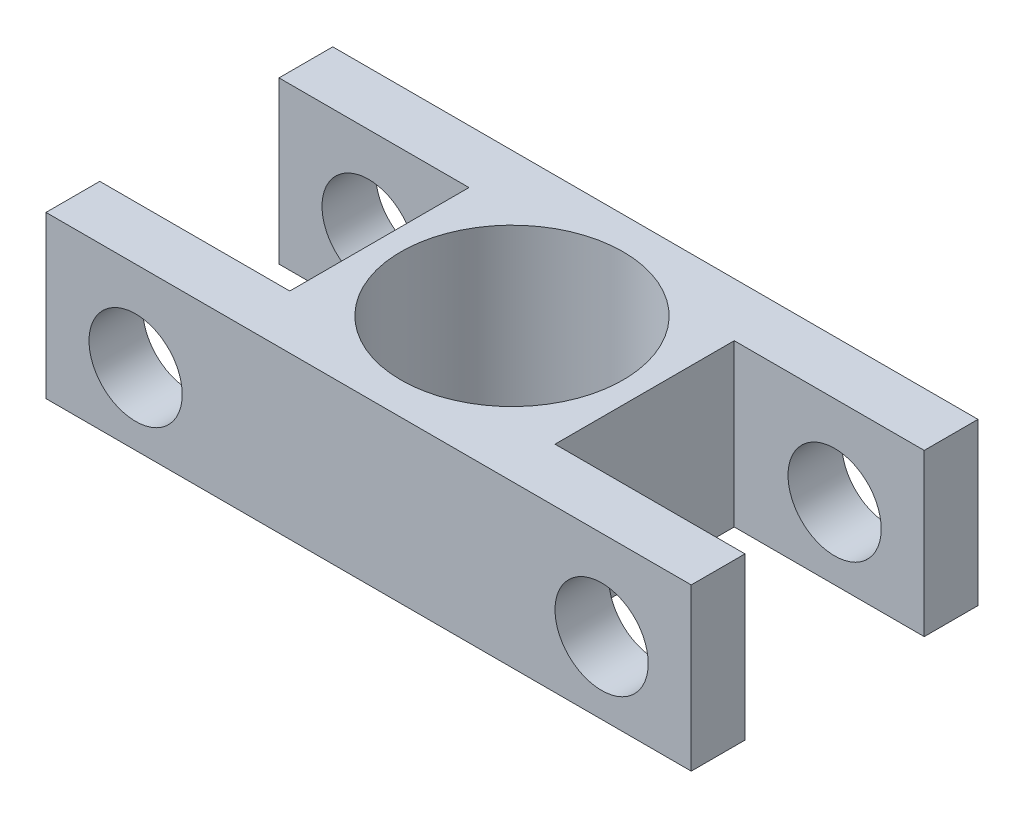
from build123d import *

# Parameters (mm, degrees)
SKETCH_1_W              = 36
SKETCH_1_H              = 9
BLOCKEXTRUDE_DEPTH      = 16
SKETCH_3_W              = 12.6
SKETCH_3_H              = 13
CLEVIS_SLOT_DEPTH       = 5
SKETCH_4_W              = 12.6
SKETCH_4_H              = 13
CUT_EXTRUDE_2_DEPTH     = 5
SKETCH_5_R              = 2.6
PIVOT_BORE_DEPTH        = 41.410394702
SKETCH_6_R              = 2.6
CUT_EXTRUDE_4_DEPTH     = 41.410394702
SKETCH_7_R              = 6.2
SPINDLE_CLEARANCE_DEPTH = 41.410394702


with BuildPart() as part:
    # 草图1 → BlockExtrude (new body)
    with BuildSketch(Plane.XY):
        with Locations((18, 4.5)):
            Rectangle(SKETCH_1_W, SKETCH_1_H)
    extrude(amount=BLOCKEXTRUDE_DEPTH)

    # 草图3 → Clevis_slot (cut, symmetric)
    with BuildSketch(Plane.XY.offset(8)):
        with Locations((4.3, 4.5)):
            Rectangle(SKETCH_3_W, SKETCH_3_H)
    extrude(amount=CLEVIS_SLOT_DEPTH, both=True, mode=Mode.SUBTRACT)

    # 草图4 → 切除-拉伸2 (cut, symmetric)
    with BuildSketch(Plane.XY.offset(8)):
        with Locations((31.7, 4.5)):
            Rectangle(SKETCH_4_W, SKETCH_4_H)
    extrude(amount=CUT_EXTRUDE_2_DEPTH, both=True, mode=Mode.SUBTRACT)

    # 草图5 → Pivot_bore (cut, through all)
    with BuildSketch(Plane.XY.offset(16)):
        with Locations((5, 4)):
            Circle(SKETCH_5_R)
    extrude(amount=-PIVOT_BORE_DEPTH, mode=Mode.SUBTRACT)

    # 草图6 → 切除-拉伸4 (cut, through all)
    with BuildSketch(Plane.XY.offset(16)):
        with Locations((31, 4)):
            Circle(SKETCH_6_R)
    extrude(amount=-CUT_EXTRUDE_4_DEPTH, mode=Mode.SUBTRACT)

    # 草图7 → Spindle_clearance (cut, through all)
    with BuildSketch(Plane(origin=(0, 9, 0), x_dir=(1, 0, 0), z_dir=(0, 1, 0))):
        with Locations(Location((18, -8, 0), (0, 0, 270))):
            Circle(SKETCH_7_R)
    extrude(amount=-SPINDLE_CLEARANCE_DEPTH, mode=Mode.SUBTRACT)


solid = part.part
